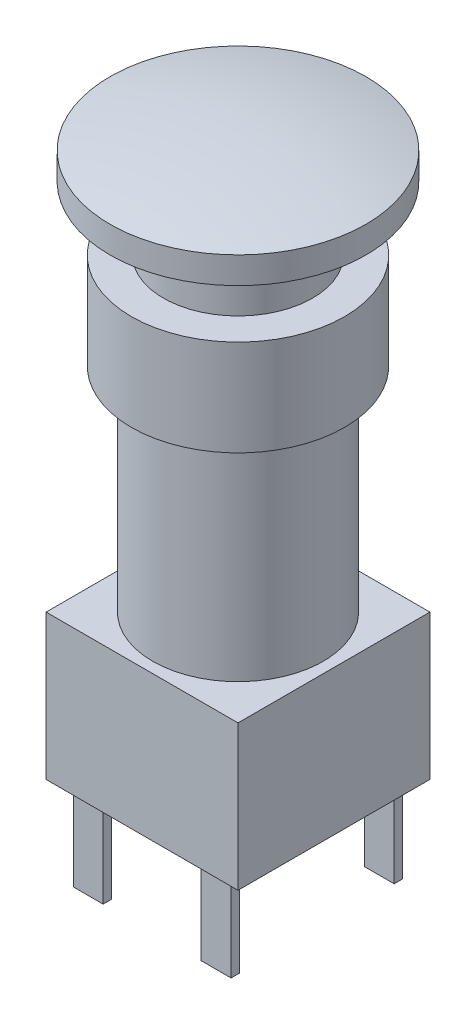
from build123d import *

# Parameters (mm, degrees)
ESQUISSE2_W        = 18
ESQUISSE2_H        = 18
BOSS_EXTRU_1_DEPTH = 13.6
ESQUISSE3_W        = 2.8
ESQUISSE3_H        = 0.8
BOSS_EXTRU_2_DEPTH = 8.4


with BuildPart() as part:
    # Esquisse1 → Révolution1 (revolve)
    with BuildSketch(Plane.XY, mode=Mode.PRIVATE) as r_volution1_sk:
        with BuildLine():
            Line((0, 19), (0, 0))
            Line((0, 0), (0, -20))
            Line((0, -20), (8, -20))
            Line((8, -20), (8, 0))
            Line((8, 0), (10, 0))
            Line((10, 0), (10, 9))
            Line((10, 9), (7, 9))
            Line((7, 9), (7, 15))
            Line((7, 15), (12, 15))
            Line((12, 15), (12, 17.5))
            ThreePointArc((12, 17.5), (6.046693311, 18.62354649), (0, 19))
        make_face()
    revolve(r_volution1_sk.sketch.rotate(Axis((0, 19, 0), (0, 1, 0)), 90), axis=Axis((0, 19, 0), (0, 1, 0)))

    # Esquisse2 → Boss.-Extru.1 (add)
    with BuildSketch(Plane.XZ.offset(20)):
        Rectangle(ESQUISSE2_W, ESQUISSE2_H)
    extrude(amount=BOSS_EXTRU_1_DEPTH)

    # Esquisse3 → Boss.-Extru.2 (add)
    with BuildSketch(Plane.XZ.offset(33.6)):
        with Locations((-6, 7.65)):
            Rectangle(ESQUISSE3_W, ESQUISSE3_H)
        with Locations((6, 7.65)):
            Rectangle(ESQUISSE3_W, ESQUISSE3_H)
        with Locations((6, -7.65)):
            Rectangle(ESQUISSE3_W, ESQUISSE3_H)
        with Locations((-6, -7.65)):
            Rectangle(ESQUISSE3_W, ESQUISSE3_H)
    extrude(amount=BOSS_EXTRU_2_DEPTH)


solid = part.part
